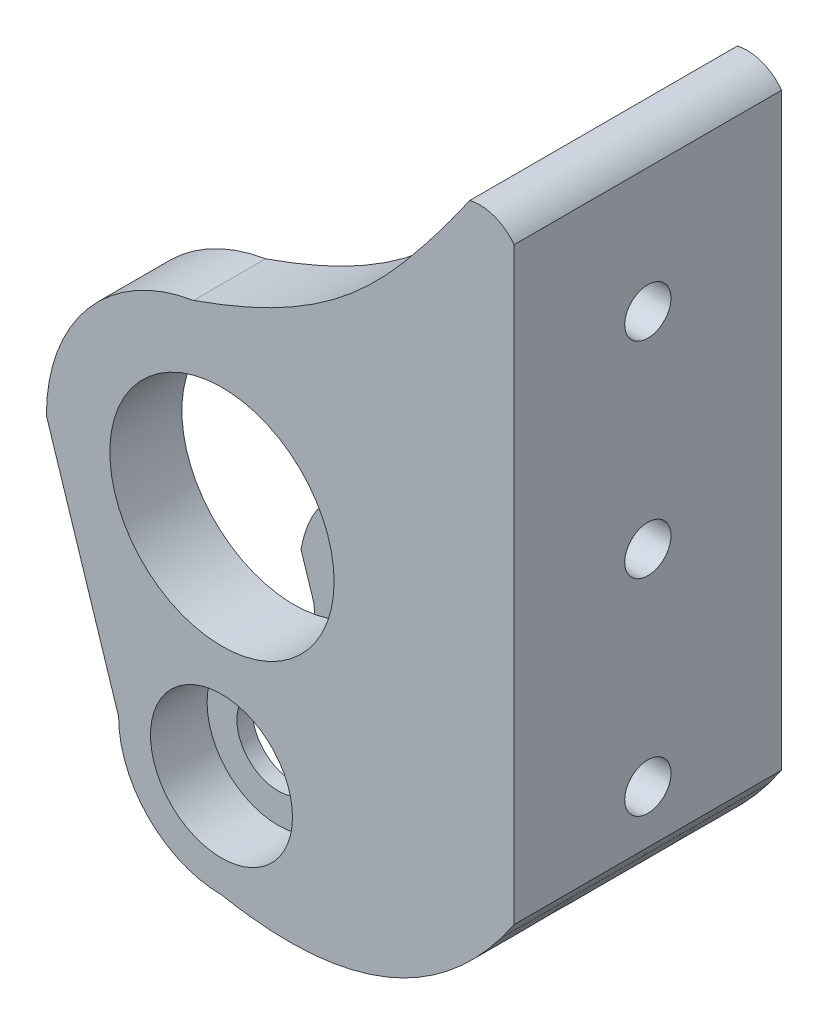
from build123d import *

# Parameters (mm, degrees)
SKETCH1_R           = 6.9
SKETCH1_R_2         = 10.9
BOSS_EXTRUDE1_DEPTH = 7
BOSS_EXTRUDE2_DEPTH = 12
CUT_EXTRUDE1_DEPTH  = 13
BOSS_EXTRUDE3_DEPTH = 26
SKETCH5_R           = 7.973914392
SKETCH5_R_2         = 4
BOSS_EXTRUDE4_DEPTH = 1.5
BOSS_EXTRUDE5_START = -1.5
SKETCH6_R           = 8.491099949
SKETCH6_R_2         = 4
BOSS_EXTRUDE5_DEPTH = 1.5
SKETCH7_R           = 2.25
CUT_EXTRUDE2_DEPTH  = 99.438905233


with BuildPart() as part:
    # Sketch1 → Boss-Extrude1 (new body)
    with BuildSketch(Plane.XY):
        with BuildLine():
            ThreePointArc((-109.99286225, 64.498694041), (-120.238224228, 58.705152002), (-124.296770504, 47.657040238))
            Line((-124.296770504, 47.657040238), (-117.277493754, 25.812066819))
            ThreePointArc((-117.277493754, 25.812066819), (-114.348561566, 18.740999007), (-107.277493754, 15.812066819))
            add(Edge.make_bspline(
                [(-80.055270229, 25.812066819), (-90.16574855, 12.494826539), (-107.277493754, 15.812066819)],
                knots=[0, 0, 0, 1, 1, 1], degree=2))
            Line((-80.055270229, 25.812066819), (-80.055270229, 84.34418562))
            ThreePointArc((-80.055270229, 84.34418562), (-81.43033647, 86.24404293), (-83.664728026, 85.531470589))
            add(Edge.make_bspline(
                [(-109.99286225, 64.498694041), (-95.736844246, 69.471166394), (-91.130917767, 75.410465429), (-83.664728026, 85.531470589)],
                knots=[0, 0, 0, 0, 0.858728352, 0.858728352, 0.858728352, 0.858728352], degree=3))
        make_face()
        with Locations((-107.277493754, 25.812066819)):
            Circle(SKETCH1_R, mode=Mode.SUBTRACT)
        with Locations((-107.22999807, 47.657040238)):
            Circle(SKETCH1_R_2, mode=Mode.SUBTRACT)
    boss_extrude1 = extrude(amount=BOSS_EXTRUDE1_DEPTH)

    # Sketch2 → Boss-Extrude2 (add)
    with BuildSketch(Plane.XY.offset(7)):
        with BuildLine():
            Line((-85.055270217, 83.653678118), (-85.055270217, 20.583275514))
            add(Edge.make_bspline(
                [(-85.055270217, 20.583275514), (-82.371539661, 22.76114127), (-80.055270217, 25.812066834)],
                knots=[0, 0, 0, 1, 1, 1], degree=2))
            Line((-80.055270217, 25.812066834), (-80.055270229, 84.34418562))
            ThreePointArc((-80.055270229, 84.34418562), (-81.43033647, 86.24404293), (-83.664728026, 85.531470589))
            add(Edge.make_bspline(
                [(-83.664728026, 85.531470589), (-84.138702239, 84.888961408), (-84.601149423, 84.263304749), (-85.055270217, 83.653678118)],
                knots=[0, 0, 0, 0, 0.054514432, 0.054514432, 0.054514432, 0.054514432], degree=3))
        make_face()
    extrude(amount=BOSS_EXTRUDE2_DEPTH)

    # Mirror1: Boss-Extrude1 across plane
    add(boss_extrude1.mirror(Plane.XY.offset(13)))

    # Sketch3 → Cut-Extrude1 (cut)
    with BuildSketch(Plane(origin=(0, 0, 0), x_dir=(-1, 0, 0), z_dir=(0, 0, -1))):
        with BuildLine():
            Line((92.850529653, 74.397721592), (144.531216933, 88.865819457))
            Line((144.531216933, 88.865819457), (118.546118501, 29.760204905))
            add(Edge.make_bspline(
                [(107.22999807, 36.757040238), (116.864311021, 38.600442381), (118.546118501, 29.760204905)],
                knots=[0, 0, 0, 1, 1, 1], degree=2))
            ThreePointArc((107.22999807, 36.757040238), (99.522534155, 39.949576323), (96.32999807, 47.657040238))
            add(Edge.make_bspline(
                [(92.850529653, 74.397721592), (90.423550402, 60.160750292), (96.32999807, 47.657040238)],
                knots=[0, 0, 0, 1, 1, 1], degree=2))
        make_face()
    extrude(amount=-CUT_EXTRUDE1_DEPTH, mode=Mode.SUBTRACT)

    # Sketch4 → Boss-Extrude3 (add)
    with BuildSketch(Plane(origin=(0, 0, 0), x_dir=(-1, 0, 0), z_dir=(0, 0, -1))):
        with BuildLine():
            Line((83.132797407, 86.34418562), (85.055270217, 83.653678118))
            Line((85.055270217, 83.653678118), (85.055270214, 20.587782524))
            add(Edge.make_bspline(
                [(78.82999807, 27.533016311), (81.645897876, 23.355716893), (85.055270214, 20.587782524)],
                knots=[0, 0, 0, 1, 1, 1], degree=2))
            Line((78.82999807, 27.533016311), (78.82999807, 84.770259389))
            ThreePointArc((78.82999807, 84.770259389), (80.746261593, 86.200037671), (83.132797407, 86.34418562))
        make_face()
    extrude(amount=-BOSS_EXTRUDE3_DEPTH)

    # Sketch5 → Boss-Extrude4 (add)
    with BuildSketch(Plane.XY.offset(7)):
        with Locations((-107.277493754, 25.812066819)):
            Circle(SKETCH5_R)
        with Locations((-107.277493754, 25.812066819)):
            Circle(SKETCH5_R_2, mode=Mode.SUBTRACT)
    extrude(amount=-BOSS_EXTRUDE4_DEPTH)

    # Sketch6 → Boss-Extrude5 (add)
    with BuildSketch(Plane(origin=(0, 0, 19), x_dir=(-1, 0, 0), z_dir=(0, 0, -1)).offset(BOSS_EXTRUDE5_START)):
        with Locations((107.277493754, 25.812066819)):
            Circle(SKETCH6_R)
        with Locations(Location((107.277493754, 25.812066819, 0), (0, 0, 180))):
            Circle(SKETCH6_R_2, mode=Mode.SUBTRACT)
    extrude(amount=BOSS_EXTRUDE5_DEPTH)

    # Sketch7 → Cut-Extrude2 (cut, through all)
    with BuildSketch(Plane.ZY.offset(85.055270217)):
        with Locations(Location((13, 32.653678118, 0), (0, 0, 270))):
            Circle(SKETCH7_R)
        with Locations(Location((13, 52.653678118, 0), (0, 0, 270))):
            Circle(SKETCH7_R)
        with Locations(Location((13, 72.653678118, 0), (0, 0, 270))):
            Circle(SKETCH7_R)
    extrude(amount=-CUT_EXTRUDE2_DEPTH, mode=Mode.SUBTRACT)


solid = part.part
